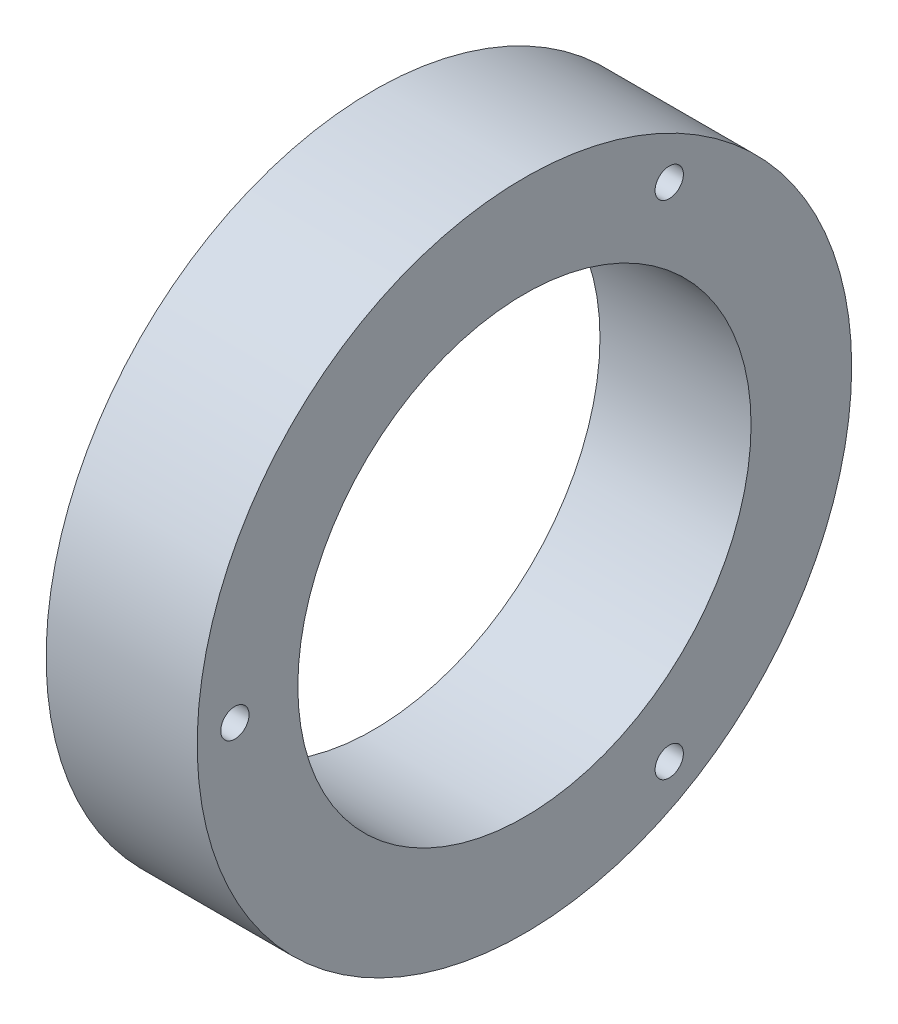
from build123d import *

# Parameters (mm, degrees)
SKETCH1_R           = 82.5246
BOSS_EXTRUDE1_DEPTH = 38.1
SKETCH2_R           = 57.15
CUT_EXTRUDE1_DEPTH  = 38.1
SKETCH3_R           = 3.5687
CUT_EXTRUDE3_DEPTH  = 123.769007532
SKETCH4_R           = 5.5626
CUT_EXTRUDE4_DEPTH  = 9.652


with BuildPart() as part:
    # Sketch1 → Boss-Extrude1 (new body)
    with BuildSketch(Plane.YZ):
        with Locations(Location((0, 0, 0), (0, 0, 270))):
            Circle(SKETCH1_R)
    extrude(amount=BOSS_EXTRUDE1_DEPTH)

    # Sketch2 → Cut-Extrude1 (cut)
    with BuildSketch(Plane.YZ):
        with Locations(Location((0, 0, 0), (0, 0, 270))):
            Circle(SKETCH2_R)
    extrude(amount=CUT_EXTRUDE1_DEPTH, mode=Mode.SUBTRACT)

    # Sketch3 → Cut-Extrude3 (cut, through all)
    with BuildSketch(Plane.YZ):
        with Locations(Location((0, 73.025, 0), (0, 0, 270))):
            Circle(SKETCH3_R)
        with Locations(Location((-63.241505111, -36.5125, 0), (0, 0, 270))):
            Circle(SKETCH3_R)
        with Locations(Location((63.241505111, -36.5125, 0), (0, 0, 270))):
            Circle(SKETCH3_R)
    extrude(amount=CUT_EXTRUDE3_DEPTH, mode=Mode.SUBTRACT)

    # Sketch4 → Cut-Extrude4 (cut)
    with BuildSketch(Plane.YZ):
        with Locations(Location((0, 73.025, 0), (0, 0, 270))):
            Circle(SKETCH4_R)
        with Locations(Location((-63.241505111, -36.5125, 0), (0, 0, 270))):
            Circle(SKETCH4_R)
        with Locations(Location((63.241505111, -36.5125, 0), (0, 0, 270))):
            Circle(SKETCH4_R)
    extrude(amount=CUT_EXTRUDE4_DEPTH, mode=Mode.SUBTRACT)


solid = part.part
